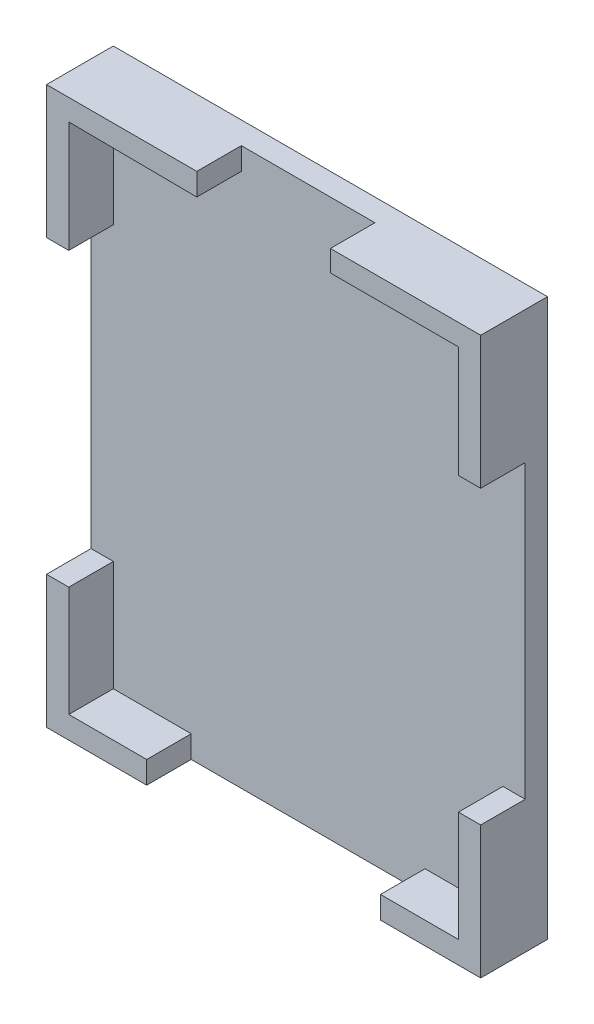
from build123d import *

# Parameters (mm, degrees)
SKETCH1_W           = 39
SKETCH1_H           = 50
BOSS_EXTRUDE1_DEPTH = 2
BOSS_EXTRUDE2_DEPTH = 6


with BuildPart() as part:
    # Sketch1 → Boss-Extrude1 (new body)
    with BuildSketch(Plane.XY):
        with Locations((19.5, 25)):
            Rectangle(SKETCH1_W, SKETCH1_H)
    extrude(amount=BOSS_EXTRUDE1_DEPTH)

    # Sketch1<4> → Boss-Extrude2 (add)
    with BuildSketch(Plane.XY):
        Polygon((13.5, 50), (0, 50), (0, 38.094718221), (2, 38.094718221), (2, 48.094718221), (13.5, 48), align=None)
        Polygon((39, 50), (25.5, 50), (25.5, 48.094718221), (37, 48.094718221), (37, 38.094718221), (39, 38.094718221), align=None)
        Polygon((2, 11.905281779), (0, 11.905281779), (0, 0), (9, 0), (9, 2), (2, 2), align=None)
        Polygon((39, 0), (39, 11.905281779), (37, 11.905281779), (37, 2), (30, 2), (30, 0), align=None)
    extrude(amount=BOSS_EXTRUDE2_DEPTH)


solid = part.part
